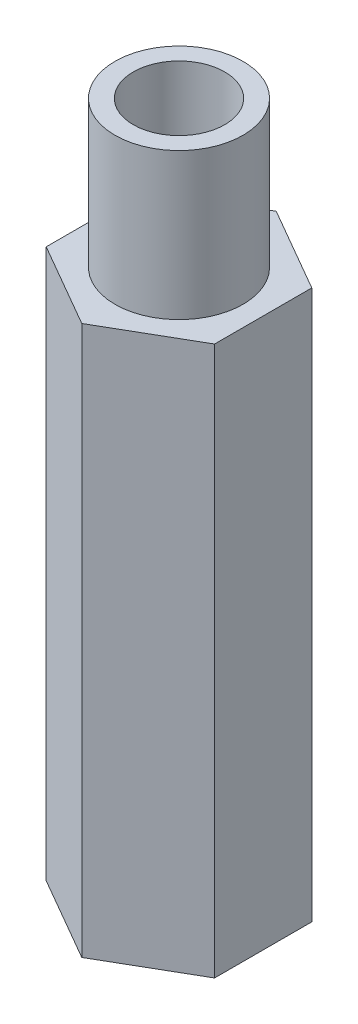
from build123d import *

# Parameters (mm, degrees)
EXTRUDE_1_DEPTH    = 15
SKETCH_2_R         = 1.75
EXTRUDE_2_DEPTH    = 4
HOLE_WIZARD_M3_1_D = 2.5


with BuildPart() as part:
    # 草图1 → 凸台-拉伸1 (new body)
    with BuildSketch(Plane(origin=(0, 0, 0), x_dir=(1, 0, 0), z_dir=(0, 1, 0))):
        Polygon((0, 2.655811238), (-2.3, 1.327905619), (-2.3, -1.327905619), (0, -2.655811238), (2.3, -1.327905619), (2.3, 1.327905619), align=None)
    extrude(amount=EXTRUDE_1_DEPTH)

    # 草图2 → 凸台-拉伸2 (add)
    with BuildSketch(Plane(origin=(0, 15, 0), x_dir=(1, 0, 0), z_dir=(0, 1, 0))):
        with Locations(Location((0, 0, 0), (0, 0, 270))):
            Circle(SKETCH_2_R)
    extrude(amount=EXTRUDE_2_DEPTH)

    # M3 螺纹孔1 (through all)
    with Locations(Plane(origin=(0, 19, 0), x_dir=(1, 0, 0), z_dir=(0, 1, 0))):
        with Locations((0, 0)):
            Hole(HOLE_WIZARD_M3_1_D / 2)


solid = part.part
